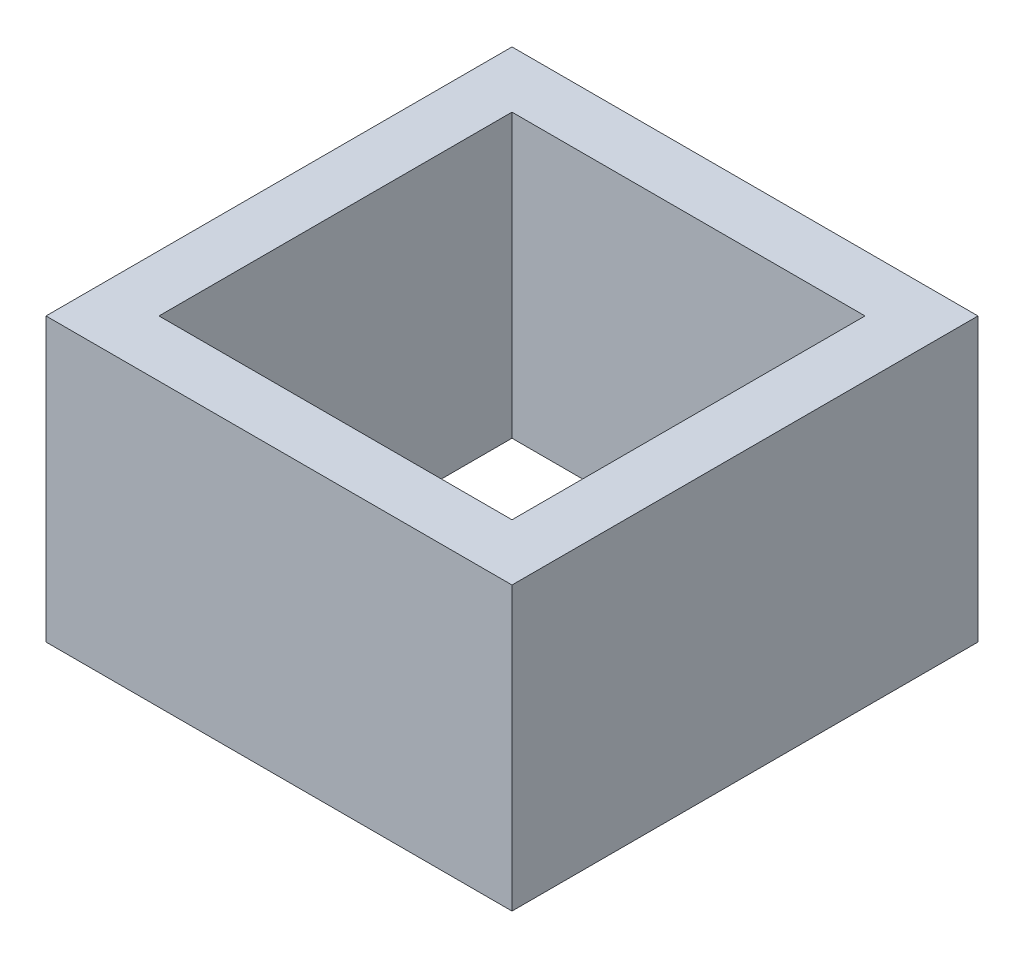
from build123d import *

# Parameters (mm, degrees)
ESQUISSE1_W        = 330
ESQUISSE1_H        = 330
ESQUISSE1_W_2      = 250
ESQUISSE1_H_2      = 250
BOSS_EXTRU_1_DEPTH = 200


with BuildPart() as part:
    # Esquisse1 → Boss.-Extru.1 (new body)
    with BuildSketch(Plane(origin=(0, 0, 0), x_dir=(1, 0, 0), z_dir=(0, 1, 0))):
        Rectangle(ESQUISSE1_W, ESQUISSE1_H)
        Rectangle(ESQUISSE1_W_2, ESQUISSE1_H_2, mode=Mode.SUBTRACT)
    extrude(amount=-BOSS_EXTRU_1_DEPTH)


solid = part.part
